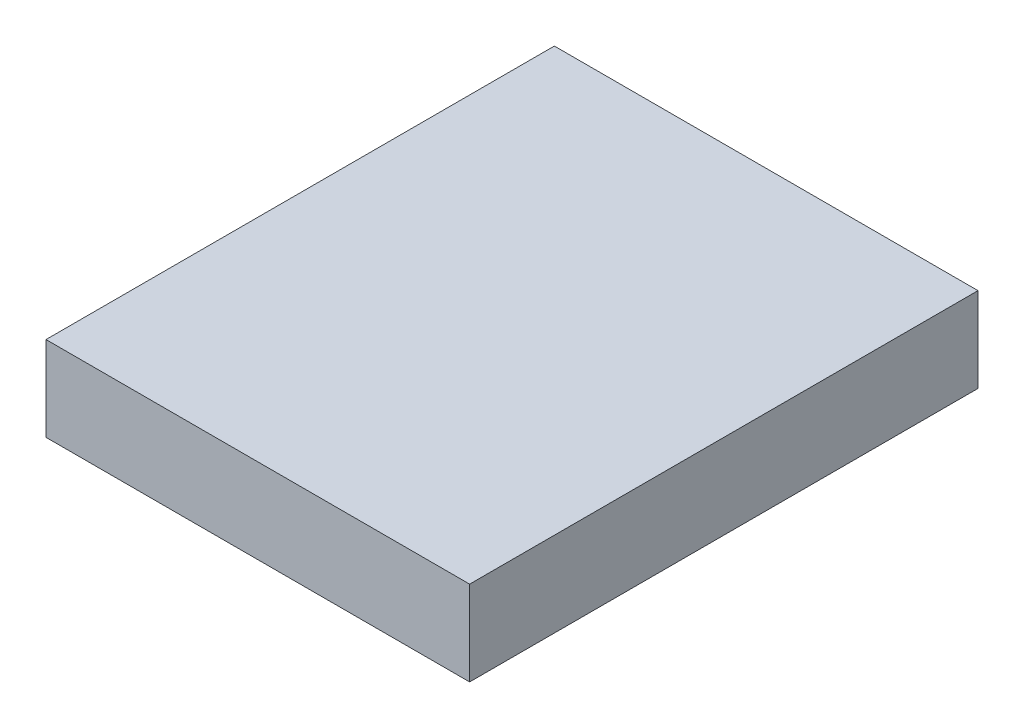
from build123d import *

# Parameters (mm, degrees)
CROQUIS1_W              = 25
CROQUIS1_H              = 30
SALIENTE_EXTRUIR1_DEPTH = 5


with BuildPart() as part:
    # Croquis1 → Saliente-Extruir1 (new body)
    with BuildSketch(Plane(origin=(0, 0, 0), x_dir=(1, 0, 0), z_dir=(0, 1, 0))):
        Rectangle(CROQUIS1_W, CROQUIS1_H)
    extrude(amount=SALIENTE_EXTRUIR1_DEPTH)


solid = part.part
